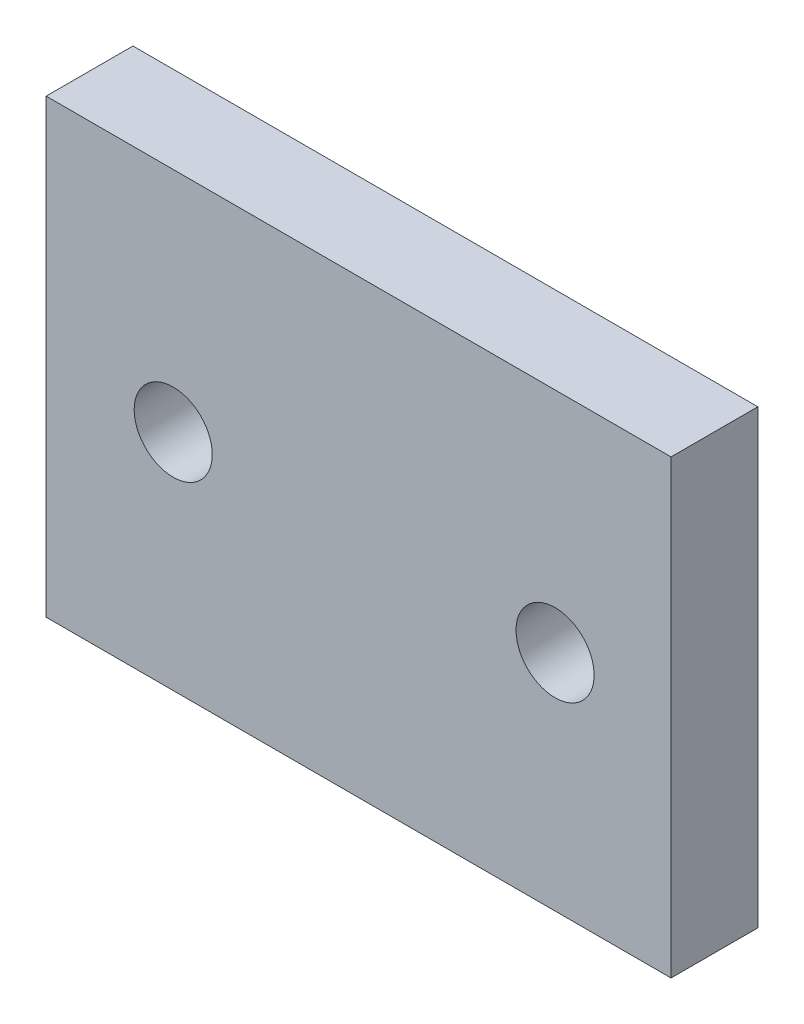
from build123d import *

# Parameters (mm, degrees)
ESQUISSE1_W        = 36
ESQUISSE1_H        = 26
BOSS_EXTRU_1_DEPTH = 5
D_GAGEMENT_M41_D   = 4.5


with BuildPart() as part:
    # Esquisse1 → Boss.-Extru.1 (new body)
    with BuildSketch(Plane.XY):
        Rectangle(ESQUISSE1_W, ESQUISSE1_H)
    extrude(amount=BOSS_EXTRU_1_DEPTH)

    # Dégagement M41 (through all)
    with Locations(Plane(origin=(0, 0, 0), x_dir=(-1, 0, 0), z_dir=(0, 0, -1))):
        with Locations((-11.318887596, -0.107841378), (10.681112224, -0.10502754)):
            Hole(D_GAGEMENT_M41_D / 2)


solid = part.part
